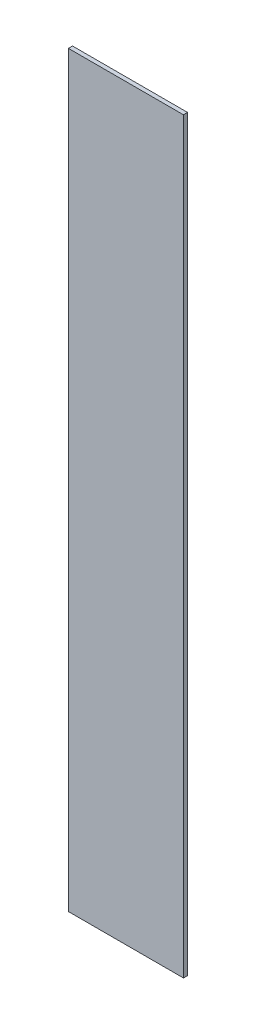
from build123d import *

# Parameters (mm, degrees)
OVEN_YAG_KABI_KAPAGI_KULP_CUKURU_1_START = 26
SKETCH1_W                                = 28
SKETCH1_H                                = 182
OVEN_YAG_KABI_KAPAGI_KULP_CUKURU_1_DEPTH = 1


with BuildPart() as part:
    # Sketch1 → OVEN_yag_kabi_kapagi_kulp_cukuru_1 (new body)
    with BuildSketch(Plane.XY.offset(OVEN_YAG_KABI_KAPAGI_KULP_CUKURU_1_START)):
        with Locations((147, 970)):
            Rectangle(SKETCH1_W, SKETCH1_H)
    extrude(amount=OVEN_YAG_KABI_KAPAGI_KULP_CUKURU_1_DEPTH)


solid = part.part
